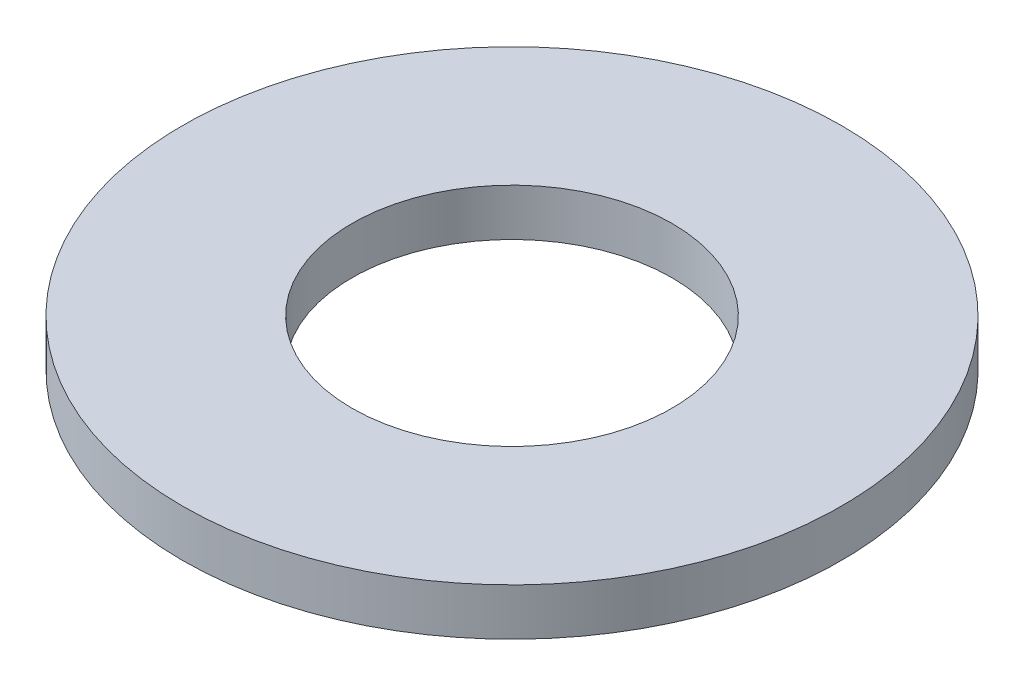
from build123d import *

# Parameters (mm, degrees)
SKETCH_1_W = 1.8
SKETCH_1_H = 0.5


with BuildPart() as part:
    # 草图1 → Revolve 437 (revolve)
    with BuildSketch(Plane.XY, mode=Mode.PRIVATE) as revolve_437_sk:
        with Locations((-2.6, 8.894507042)):
            Rectangle(SKETCH_1_W, SKETCH_1_H)
    revolve(revolve_437_sk.sketch.rotate(Axis((0, 0, 0), (0, 1, 0)), 270), axis=Axis((0, 0, 0), (0, 1, 0)))


solid = part.part
